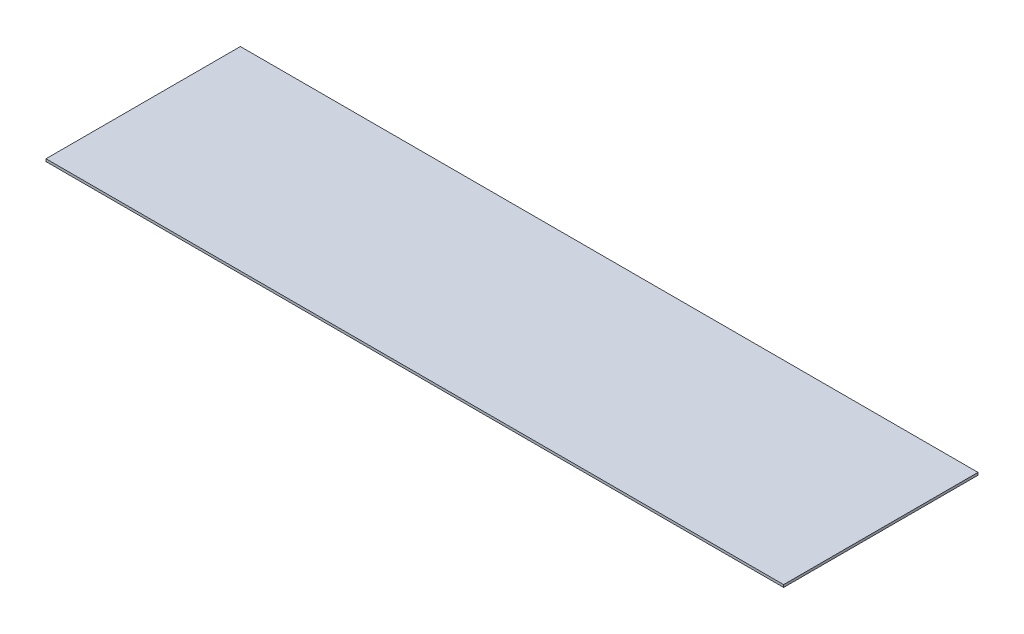
from build123d import *

# Parameters (mm, degrees)
SKETCH1_W           = 469.9
SKETCH1_H           = 123.825
BOSS_EXTRUDE1_DEPTH = 1.5875


with BuildPart() as part:
    # Sketch1 → Boss-Extrude1 (new body)
    with BuildSketch(Plane(origin=(0, 0, 0), x_dir=(1, 0, 0), z_dir=(0, 1, 0))):
        with Locations((169.731067505, -31.057803237)):
            Rectangle(SKETCH1_W, SKETCH1_H)
    extrude(amount=-BOSS_EXTRUDE1_DEPTH)


solid = part.part
